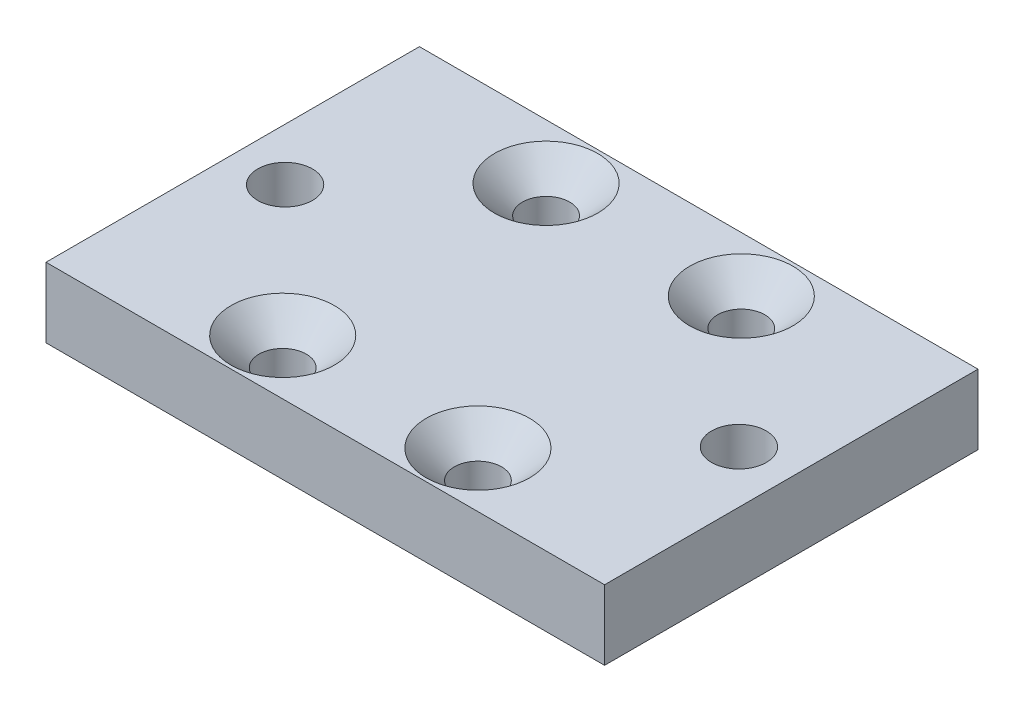
from build123d import *

# Parameters (mm, degrees)
SKETCH1_W                                       = 50.8
SKETCH1_H                                       = 33.9598
BOSS_EXTRUDE1_DEPTH                             = 6.35
SKETCH2_R                                       = 1.905
THROUGH_TO_BEARING_BLOCK_DEPTH                  = 62.434766346
SKETCH3_R                                       = 2.4892
THROUGH_TO_TNUT_DEPTH                           = 62.434766346
CSK_FOR_M4_FLAT_HEAD_MACHINE_SCREW1_D           = 4.3
CSK_FOR_M4_FLAT_HEAD_MACHINE_SCREW1_CSINK_D     = 9.4
CSK_FOR_M4_FLAT_HEAD_MACHINE_SCREW1_CSINK_ANGLE = 90


with BuildPart() as part:
    # Sketch1 → Boss-Extrude1 (new body)
    with BuildSketch(Plane(origin=(0, 0, 0), x_dir=(1, 0, 0), z_dir=(0, 1, 0))):
        with Locations((25.4, 16.9799)):
            Rectangle(SKETCH1_W, SKETCH1_H)
    extrude(amount=BOSS_EXTRUDE1_DEPTH)

    # Sketch2 → through to bearing block (cut, through all)
    with BuildSketch(Plane(origin=(0, 6.35, 0), x_dir=(1, 0, 0), z_dir=(0, 1, 0))):
        with Locations(Location((16.5227, 28.956, 0), (0, 0, 270))):
            Circle(SKETCH2_R)
        with Locations(Location((16.5227, 5.0038, 0), (0, 0, 270))):
            Circle(SKETCH2_R)
        with Locations(Location((34.2773, 28.956, 0), (0, 0, 270))):
            Circle(SKETCH2_R)
        with Locations(Location((34.2773, 5.0038, 0), (0, 0, 270))):
            Circle(SKETCH2_R)
    extrude(amount=-THROUGH_TO_BEARING_BLOCK_DEPTH, mode=Mode.SUBTRACT)

    # Sketch3 → through to tnut (cut, through all)
    with BuildSketch(Plane(origin=(0, 6.35, 0), x_dir=(1, 0, 0), z_dir=(0, 1, 0))):
        with Locations(Location((4.7625, 16.9799, 0), (0, 0, 270))):
            Circle(SKETCH3_R)
        with Locations(Location((46.0375, 16.9799, 0), (0, 0, 270))):
            Circle(SKETCH3_R)
    extrude(amount=-THROUGH_TO_TNUT_DEPTH, mode=Mode.SUBTRACT)

    # CSK for M4 Flat Head Machine Screw1 (through all)
    with Locations(Plane(origin=(0, 6.35, 0), x_dir=(1, 0, 0), z_dir=(0, 1, 0))):
        with Locations((16.5227, 28.956), (16.5227, 5.0038), (34.2773, 5.0038), (34.2773, 28.956)):
            CounterSinkHole(CSK_FOR_M4_FLAT_HEAD_MACHINE_SCREW1_D / 2, CSK_FOR_M4_FLAT_HEAD_MACHINE_SCREW1_CSINK_D / 2, counter_sink_angle=CSK_FOR_M4_FLAT_HEAD_MACHINE_SCREW1_CSINK_ANGLE)


solid = part.part
